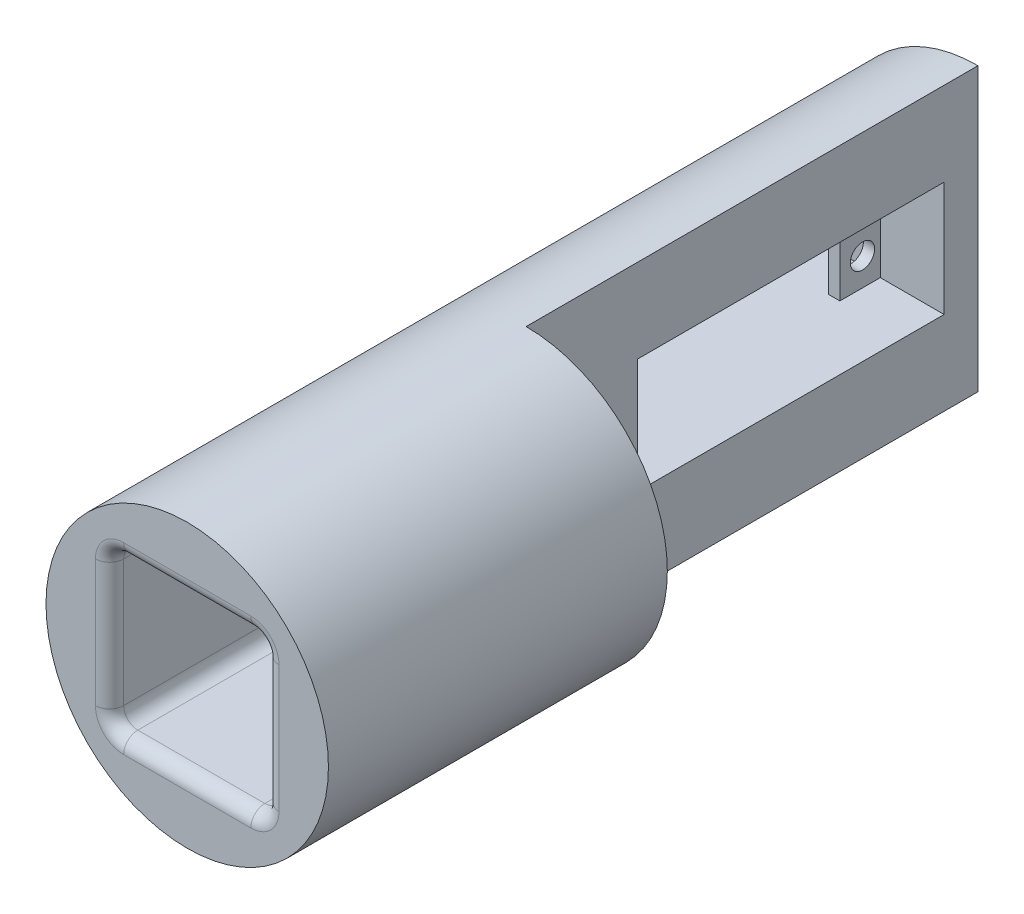
from build123d import *

# Parameters (mm, degrees)
SKETCH1_R           = 25
SKETCH1_W           = 27.5
SKETCH1_H           = 27.5
BOSS_EXTRUDE1_DEPTH = 55
BOSS_EXTRUDE2_START = 5
SKETCH2_R           = 25
BOSS_EXTRUDE2_DEPTH = 5
SKETCH3_W           = 25
SKETCH3_H           = 50
BOSS_EXTRUDE3_DEPTH = 80
FILLET1_R           = 2.5
FILLET2_R           = 2.5
SKETCH21_W          = 54.3
SKETCH21_H          = 20.3
CUT_EXTRUDE1_DEPTH  = 11.3
SKETCH22_W          = 40.3
SKETCH22_H          = 20.3
CUT_EXTRUDE2_DEPTH  = 93.059763198
CUT_EXTRUDE3_DEPTH  = 88.464278423
SKETCH23_R          = 2.15
CUT_EXTRUDE4_DEPTH  = 93.059763198
CUT_EXTRUDE7_DEPTH  = 27.5


with BuildPart() as part:
    # Sketch1 → Boss-Extrude1 (new body)
    with BuildSketch(Plane.XY):
        Circle(SKETCH1_R)
        Rectangle(SKETCH1_W, SKETCH1_H, mode=Mode.SUBTRACT)
    extrude(amount=BOSS_EXTRUDE1_DEPTH)

    # Sketch2 → Boss-Extrude2 (add)
    with BuildSketch(Plane(origin=(0, 0, 0), x_dir=(-1, 0, 0), z_dir=(0, 0, -1)).offset(BOSS_EXTRUDE2_START)):
        Circle(SKETCH2_R)
    extrude(amount=-BOSS_EXTRUDE2_DEPTH)

    # Sketch3 → Boss-Extrude3 (add)
    with BuildSketch(Plane(origin=(0, 0, -5), x_dir=(-1, 0, 0), z_dir=(0, 0, -1))):
        with Locations((12.5, 0)):
            Rectangle(SKETCH3_W, SKETCH3_H)
    extrude(amount=BOSS_EXTRUDE3_DEPTH)

    # Fillet1
    fillet1_edges = [part.edges().sort_by_distance(p)[0] for p in [
        (-13.75, 13.75, 27.5),
        (13.75, 13.75, 27.5),
        (-13.75, -13.75, 27.5),
        (13.75, -13.75, 27.5),
    ]]
    fillet(fillet1_edges, radius=FILLET1_R)

    # Fillet2
    fillet2_edges = [part.edges().sort_by_distance(p)[0] for p in [
        (13.75, 0, 55),
    ]]
    fillet(fillet2_edges, radius=FILLET2_R)

    # Sketch21 → Cut-Extrude1 (cut)
    with BuildSketch(Plane(origin=(0, 0, 0), x_dir=(0, 0, -1), z_dir=(1, 0, 0))):
        with Locations((51.85, 0)):
            Rectangle(SKETCH21_W, SKETCH21_H)
    extrude(amount=-CUT_EXTRUDE1_DEPTH, mode=Mode.SUBTRACT)

    # Sketch22 → Cut-Extrude2 (cut, through all)
    with BuildSketch(Plane(origin=(0, 0, 0), x_dir=(0, 0, -1), z_dir=(1, 0, 0))):
        with Locations((51.7, 0)):
            Rectangle(SKETCH22_W, SKETCH22_H)
    extrude(amount=-CUT_EXTRUDE2_DEPTH, mode=Mode.SUBTRACT)

    # Sketch18 → Cut-Extrude3 (cut, through all)
    with BuildSketch(Plane.XY.offset(-5)):
        with BuildLine():
            Line((-25, -25), (0, -25))
            ThreePointArc((0, -25), (-17.67766953, -17.67766953), (-25, 0))
            Line((-25, 0), (-25, -25))
        make_face()
        with BuildLine():
            Line((-25, 25), (-25, 0))
            ThreePointArc((-25, 0), (-17.67766953, 17.67766953), (0, 25))
            Line((0, 25), (-25, 25))
        make_face()
    extrude(amount=-CUT_EXTRUDE3_DEPTH, mode=Mode.SUBTRACT)

    # Sketch23 → Cut-Extrude4 (cut, through all)
    with BuildSketch(Plane(origin=(0, 0, 0), x_dir=(0, 0, -1), z_dir=(1, 0, 0))):
        with Locations((75.85, 5.25)):
            Circle(SKETCH23_R)
        with Locations((75.85, -5.25)):
            Circle(SKETCH23_R)
        with Locations((27.85, 5.25)):
            Circle(SKETCH23_R)
        with Locations((27.85, -5.25)):
            Circle(SKETCH23_R)
    extrude(amount=-CUT_EXTRUDE4_DEPTH, mode=Mode.SUBTRACT)

    # Sketch24 → Cut-Extrude7 (cut, symmetric)
    with BuildSketch(Plane(origin=(0, 0, -51.7), x_dir=(-1, 0, 0), z_dir=(0, 0, -1))):
        with BuildLine():
            Line((13.3, 10.15), (13.3, -10.15))
            Line((13.3, -10.15), (22.846826913, -10.15))
            ThreePointArc((22.846826913, -10.15), (25, 0), (22.846826913, 10.15))
            Line((22.846826913, 10.15), (13.3, 10.15))
        make_face()
    extrude(amount=CUT_EXTRUDE7_DEPTH, both=True, mode=Mode.SUBTRACT)


solid = part.part
